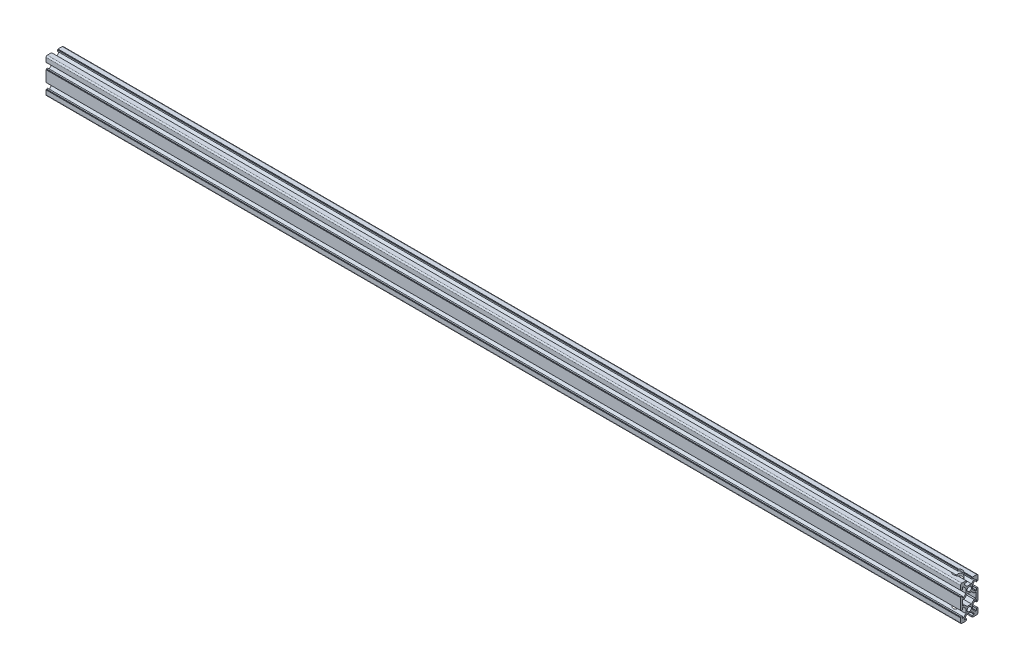
from build123d import *

# Parameters (mm, degrees)
SKETCH_1_W                = 1048
SKETCH_1_H                = 40
EXTRUDE_1_DEPTH           = 20
CUT_EXTRUDE_1_DEPTH       = 1049.239330799
CUT_EXTRUDE_2_REACH       = 1050.811
CUT_EXTRUDE_3_REACH       = 1050.239
CUT_EXTRUDE_3_END_RADIUS  = 5
SKETCH_4_W                = 0.605
SKETCH_4_H                = 0.5
CUT_EXTRUDE_4_DEPTH       = 1049.239330799
CUT_EXTRUDE_5_DEPTH       = 1049.737119623
CUT_EXTRUDE_6_REACH       = 1050.239
CUT_EXTRUDE_6_END_RADIUS  = 5
SKETCH_7_W                = 0.605
SKETCH_7_H                = 0.5
CUT_EXTRUDE_7_REACH       = 1050.811
CUT_EXTRUDE_8_REACH       = 1050.239
CUT_EXTRUDE_8_END_RADIUS  = 5
SKETCH_9_W                = 0.605
SKETCH_9_H                = 0.5
CUT_EXTRUDE_9_REACH       = 1050.239
CUT_EXTRUDE_9_END_RADIUS  = 5
SKETCH_10_W               = 0.605
SKETCH_10_H               = 0.5
CUT_EXTRUDE_10_DEPTH      = 1049.737119623
CUT_EXTRUDE_11_REACH      = 1050.239
CUT_EXTRUDE_11_END_RADIUS = 5
SKETCH_12_W               = 0.605
SKETCH_12_H               = 0.5
CUT_EXTRUDE_12_DEPTH      = 1049.239330799
CUT_EXTRUDE_13_DEPTH      = 1049.239330799
CUT_EXTRUDE_14_REACH      = 1050.239
CUT_EXTRUDE_14_END_RADIUS = 5
SKETCH_15_W               = 0.605
SKETCH_15_H               = 0.5
CUT_EXTRUDE_15_REACH      = 1050.239
CUT_EXTRUDE_15_END_RADIUS = 5
SKETCH_16_W               = 0.605
SKETCH_16_H               = 0.5
CUT_EXTRUDE_16_DEPTH      = 1049.239330799
CUT_EXTRUDE_17_DEPTH      = 1049.239330799
CUT_EXTRUDE_18_REACH      = 1050.239
CUT_EXTRUDE_18_END_RADIUS = 5
SKETCH_19_W               = 0.605
SKETCH_19_H               = 0.5
CUT_EXTRUDE_19_DEPTH      = 1049.239330799
DRAFT_1_ANGLE             = 45
DRAFT_2_ANGLE             = 45
SKETCH_21_W               = 5
SKETCH_21_H               = 5.49122085
SKETCH_22_W               = 5
SKETCH_22_H               = 5.49864809
HOLE_WIZARD_5_0_5_1_D     = 4.999999999
HOLE_WIZARD_5_0_5_2_D     = 4.999999999
FILLET_1_R                = 1.5


with BuildPart() as part:
    # 草图1 → 凸台-拉伸1 (new body)
    with BuildSketch(Plane.XY.offset(9.92299271)):
        with Locations((-524, -0.00371362)):
            Rectangle(SKETCH_1_W, SKETCH_1_H)
    extrude(amount=-EXTRUDE_1_DEPTH)

    # 草图2 → 切除-拉伸1 (cut, through all)
    with BuildSketch(Plane(origin=(0, 0, 0), x_dir=(0, 0, -1), z_dir=(1, 0, 0))):
        Polygon((-3.02299271, 19.99628638), (-3.02299271, 17.99628638), (-5.42299271, 17.99628638), (-5.42299271, 16.91049994), (-2.40877915, 13.89628638), (2.56279373, 13.89628638), (5.57700729, 16.91049994), (5.57700729, 17.99628638), (3.17700729, 17.99628638), (3.17700729, 19.99628638), align=None)
    extrude(amount=-CUT_EXTRUDE_1_DEPTH, mode=Mode.SUBTRACT)

    # 草图3 → 切除-拉伸2 (cut, up to next)
    with BuildSketch(Plane(origin=(0, 19.99628638, 0), x_dir=(-1, 0, 0), z_dir=(0, 1, 0)), mode=Mode.PRIVATE) as cut_extrude_2_sk1:
        with BuildLine():
            Line((9.017348236, 3.02299271), (16.982651764, 3.02299271))
            ThreePointArc((16.982651764, 3.02299271), (13, 5), (9.017348236, 3.02299271))
        make_face()
    cut_extrude_2_tool1 = extrude(cut_extrude_2_sk1.sketch, amount=-CUT_EXTRUDE_2_REACH, mode=Mode.PRIVATE) & part.part
    add(cut_extrude_2_tool1.solids().sort_by_distance((-13, 19.996286, 3.828944))[0], mode=Mode.SUBTRACT)

    # 切除-拉伸3: up to this cylinder (the profile starts outside it)
    cut_extrude_3_end = Plane(origin=(-13, 19.746286, 0), z_dir=(0, 1, 0)) * Cylinder(CUT_EXTRUDE_3_END_RADIUS, 2111.478, mode=Mode.PRIVATE)
    # 草图4 → 切除-拉伸3 (cut, up to the surface)
    with BuildSketch(Plane.ZY.offset(1048), mode=Mode.PRIVATE) as cut_extrude_3_sk1:
        with Locations((3.32549271, 19.74628638)):
            Rectangle(SKETCH_4_W, SKETCH_4_H)
    cut_extrude_3_tool1 = extrude(cut_extrude_3_sk1.sketch, amount=-CUT_EXTRUDE_3_REACH, mode=Mode.PRIVATE) - cut_extrude_3_end
    add(cut_extrude_3_tool1.solids().sort_by_distance((-1048, 19.746286, 3.325493))[0], mode=Mode.SUBTRACT)

    # 草图5 → 切除-拉伸4 (cut, through all)
    with BuildSketch(Plane(origin=(0, 0, 0), x_dir=(0, 0, -1), z_dir=(1, 0, 0))):
        Polygon((-3.02299271, -20.00371362), (3.17700729, -20.00371362), (3.17700729, -18.00371362), (5.57700729, -18.00371362), (5.57700729, -16.91792718), (2.56279373, -13.90371362), (-2.40877915, -13.90371362), (-5.42299271, -16.91792718), (-5.42299271, -18.00371362), (-3.02299271, -18.00371362), align=None)
    extrude(amount=-CUT_EXTRUDE_4_DEPTH, mode=Mode.SUBTRACT)

    # 草图6 → 切除-拉伸5 (cut, through all)
    with BuildSketch(Plane(origin=(0, -18.00371362, 0), x_dir=(-1, 0, 0), z_dir=(0, 1, 0))):
        with BuildLine():
            Line((9.017348236, 3.02299271), (16.982651764, 3.02299271))
            ThreePointArc((16.982651764, 3.02299271), (13, 5), (9.017348236, 3.02299271))
        make_face()
    extrude(amount=-CUT_EXTRUDE_5_DEPTH, mode=Mode.SUBTRACT)

    # 切除-拉伸6: up to this cylinder (the profile starts outside it)
    cut_extrude_6_end = Plane(origin=(-13, -19.753714, 0), z_dir=(0, 1, 0)) * Cylinder(CUT_EXTRUDE_6_END_RADIUS, 2111.478, mode=Mode.PRIVATE)
    # 草图7 → 切除-拉伸6 (cut, up to the surface)
    with BuildSketch(Plane.ZY.offset(1048), mode=Mode.PRIVATE) as cut_extrude_6_sk1:
        with Locations((3.32549271, -19.75371362)):
            Rectangle(SKETCH_7_W, SKETCH_7_H)
    cut_extrude_6_tool1 = extrude(cut_extrude_6_sk1.sketch, amount=-CUT_EXTRUDE_6_REACH, mode=Mode.PRIVATE) - cut_extrude_6_end
    add(cut_extrude_6_tool1.solids().sort_by_distance((-1048, -19.753714, 3.325493))[0], mode=Mode.SUBTRACT)

    # 草图8 → 切除-拉伸7 (cut, up to next)
    with BuildSketch(Plane.XZ.offset(20.00371362), mode=Mode.PRIVATE) as cut_extrude_7_sk1:
        with BuildLine():
            Line((-9.139090175, -3.17700729), (-16.860909825, -3.17700729))
            ThreePointArc((-16.860909825, -3.17700729), (-13, -5), (-9.139090175, -3.17700729))
        make_face()
    cut_extrude_7_tool1 = extrude(cut_extrude_7_sk1.sketch, amount=-CUT_EXTRUDE_7_REACH, mode=Mode.PRIVATE) & part.part
    add(cut_extrude_7_tool1.solids().sort_by_distance((-13, -20.003714, -3.918953))[0], mode=Mode.SUBTRACT)

    # 切除-拉伸8: up to this cylinder (the profile starts outside it)
    cut_extrude_8_end = Plane(origin=(-13, -19.753714, 0), z_dir=(0, -1, 0)) * Cylinder(CUT_EXTRUDE_8_END_RADIUS, 2111.478, mode=Mode.PRIVATE)
    # 草图9 → 切除-拉伸8 (cut, up to the surface)
    with BuildSketch(Plane.ZY.offset(1048), mode=Mode.PRIVATE) as cut_extrude_8_sk1:
        with Locations((-3.47950729, -19.75371362)):
            Rectangle(SKETCH_9_W, SKETCH_9_H)
    cut_extrude_8_tool1 = extrude(cut_extrude_8_sk1.sketch, amount=-CUT_EXTRUDE_8_REACH, mode=Mode.PRIVATE) - cut_extrude_8_end
    add(cut_extrude_8_tool1.solids().sort_by_distance((-1048, -19.753714, -3.479507))[0], mode=Mode.SUBTRACT)

    # 切除-拉伸9: up to this cylinder (the profile starts outside it)
    cut_extrude_9_end = Plane(origin=(-13, 19.746286, 0), z_dir=(0, 1, 0)) * Cylinder(CUT_EXTRUDE_9_END_RADIUS, 2111.478, mode=Mode.PRIVATE)
    # 草图10 → 切除-拉伸9 (cut, up to the surface)
    with BuildSketch(Plane(origin=(0, 0, 0), x_dir=(0, 0, -1), z_dir=(1, 0, 0)), mode=Mode.PRIVATE) as cut_extrude_9_sk1:
        with Locations((-3.32549271, 19.74628638)):
            Rectangle(SKETCH_10_W, SKETCH_10_H)
    cut_extrude_9_tool1 = extrude(cut_extrude_9_sk1.sketch, amount=-CUT_EXTRUDE_9_REACH, mode=Mode.PRIVATE) - cut_extrude_9_end
    add(cut_extrude_9_tool1.solids().sort_by_distance((0, 19.746286, 3.325493))[0], mode=Mode.SUBTRACT)

    # 草图11 → 切除-拉伸10 (cut, through all)
    with BuildSketch(Plane.XZ.offset(-17.99628638)):
        with BuildLine():
            Line((-9.139090175, -3.17700729), (-16.860909825, -3.17700729))
            ThreePointArc((-16.860909825, -3.17700729), (-13, -5), (-9.139090175, -3.17700729))
        make_face()
    extrude(amount=-CUT_EXTRUDE_10_DEPTH, mode=Mode.SUBTRACT)

    # 切除-拉伸11: up to this cylinder (the profile starts outside it)
    cut_extrude_11_end = Plane(origin=(-13, 19.746286, 0), z_dir=(0, -1, 0)) * Cylinder(CUT_EXTRUDE_11_END_RADIUS, 2111.478, mode=Mode.PRIVATE)
    # 草图12 → 切除-拉伸11 (cut, up to the surface)
    with BuildSketch(Plane(origin=(0, 0, 0), x_dir=(0, 0, -1), z_dir=(1, 0, 0)), mode=Mode.PRIVATE) as cut_extrude_11_sk1:
        with Locations((3.47950729, 19.74628638)):
            Rectangle(SKETCH_12_W, SKETCH_12_H)
    cut_extrude_11_tool1 = extrude(cut_extrude_11_sk1.sketch, amount=-CUT_EXTRUDE_11_REACH, mode=Mode.PRIVATE) - cut_extrude_11_end
    add(cut_extrude_11_tool1.solids().sort_by_distance((0, 19.746286, -3.479507))[0], mode=Mode.SUBTRACT)

    # 草图13 → 切除-拉伸12 (cut, through all)
    with BuildSketch(Plane(origin=(0, 0, 0), x_dir=(0, 0, -1), z_dir=(1, 0, 0))):
        Polygon((10.07700729, 13.70128638), (9.57700729, 13.70128638), (9.57700729, 13.09628638), (8.07700729, 13.09628638), (8.07700729, 15.49628638), (6.99122085, 15.49628638), (3.97700729, 12.48207282), (3.97700729, 7.51049994), (6.99122085, 4.49628638), (8.07700729, 4.49628638), (8.07700729, 6.89628638), (9.57700729, 6.89628638), (9.57700729, 6.29128638), (10.07700729, 6.29128638), align=None)
    extrude(amount=-CUT_EXTRUDE_12_DEPTH, mode=Mode.SUBTRACT)

    # 草图14 → 切除-拉伸13 (cut, through all)
    with BuildSketch(Plane(origin=(0, 0, 0), x_dir=(0, 0, -1), z_dir=(1, 0, 0))):
        Polygon((10.07700729, -6.29871362), (9.57700729, -6.29871362), (9.57700729, -6.90371362), (8.07700729, -6.90371362), (8.07700729, -4.50371362), (6.99122085, -4.50371362), (3.97700729, -7.51792718), (3.97700729, -12.48950006), (6.99122085, -15.50371362), (8.07700729, -15.50371362), (8.07700729, -13.10371362), (9.57700729, -13.10371362), (9.57700729, -13.70871362), (10.07700729, -13.70871362), align=None)
    extrude(amount=-CUT_EXTRUDE_13_DEPTH, mode=Mode.SUBTRACT)

    # 切除-拉伸14: up to this cylinder (the profile starts outside it)
    cut_extrude_14_end = Plane(origin=(-13, -19.753714, 0), z_dir=(0, -1, 0)) * Cylinder(CUT_EXTRUDE_14_END_RADIUS, 2111.478, mode=Mode.PRIVATE)
    # 草图15 → 切除-拉伸14 (cut, up to the surface)
    with BuildSketch(Plane(origin=(0, 0, 0), x_dir=(0, 0, -1), z_dir=(1, 0, 0)), mode=Mode.PRIVATE) as cut_extrude_14_sk1:
        with Locations((3.47950729, -19.75371362)):
            Rectangle(SKETCH_15_W, SKETCH_15_H)
    cut_extrude_14_tool1 = extrude(cut_extrude_14_sk1.sketch, amount=-CUT_EXTRUDE_14_REACH, mode=Mode.PRIVATE) - cut_extrude_14_end
    add(cut_extrude_14_tool1.solids().sort_by_distance((0, -19.753714, -3.479507))[0], mode=Mode.SUBTRACT)

    # 切除-拉伸15: up to this cylinder (the profile starts outside it)
    cut_extrude_15_end = Plane(origin=(-13, -19.753714, 0), z_dir=(0, 1, 0)) * Cylinder(CUT_EXTRUDE_15_END_RADIUS, 2111.478, mode=Mode.PRIVATE)
    # 草图16 → 切除-拉伸15 (cut, up to the surface)
    with BuildSketch(Plane(origin=(0, 0, 0), x_dir=(0, 0, -1), z_dir=(1, 0, 0)), mode=Mode.PRIVATE) as cut_extrude_15_sk1:
        with Locations((-3.32549271, -19.75371362)):
            Rectangle(SKETCH_16_W, SKETCH_16_H)
    cut_extrude_15_tool1 = extrude(cut_extrude_15_sk1.sketch, amount=-CUT_EXTRUDE_15_REACH, mode=Mode.PRIVATE) - cut_extrude_15_end
    add(cut_extrude_15_tool1.solids().sort_by_distance((0, -19.753714, 3.325493))[0], mode=Mode.SUBTRACT)

    # 草图17 → 切除-拉伸16 (cut, through all)
    with BuildSketch(Plane(origin=(0, 0, 0), x_dir=(0, 0, -1), z_dir=(1, 0, 0))):
        Polygon((-9.92299271, -13.70871362), (-9.42299271, -13.70871362), (-9.42299271, -13.10371362), (-7.92299271, -13.10371362), (-7.92299271, -15.50371362), (-6.83720627, -15.50371362), (-3.82299271, -12.48950006), (-3.82299271, -7.51792718), (-6.83720627, -4.50371362), (-7.92299271, -4.50371362), (-7.92299271, -6.90371362), (-9.42299271, -6.90371362), (-9.42299271, -6.29871362), (-9.92299271, -6.29871362), align=None)
    extrude(amount=-CUT_EXTRUDE_16_DEPTH, mode=Mode.SUBTRACT)

    # 草图18 → 切除-拉伸17 (cut, through all)
    with BuildSketch(Plane(origin=(0, 0, 0), x_dir=(0, 0, -1), z_dir=(1, 0, 0))):
        Polygon((-9.92299271, 6.29128638), (-9.42299271, 6.29128638), (-9.42299271, 6.89628638), (-7.92299271, 6.89628638), (-7.92299271, 4.49628638), (-6.83720627, 4.49628638), (-3.82299271, 7.51049994), (-3.82299271, 12.48207282), (-6.83720627, 15.49628638), (-7.92299271, 15.49628638), (-7.92299271, 13.09628638), (-9.42299271, 13.09628638), (-9.42299271, 13.70128638), (-9.92299271, 13.70128638), align=None)
    extrude(amount=-CUT_EXTRUDE_17_DEPTH, mode=Mode.SUBTRACT)

    # 切除-拉伸18: up to this cylinder (the profile starts outside it)
    cut_extrude_18_end = Plane(origin=(-13, 19.746286, 0), z_dir=(0, -1, 0)) * Cylinder(CUT_EXTRUDE_18_END_RADIUS, 2111.478, mode=Mode.PRIVATE)
    # 草图19 → 切除-拉伸18 (cut, up to the surface)
    with BuildSketch(Plane.ZY.offset(1048), mode=Mode.PRIVATE) as cut_extrude_18_sk1:
        with Locations((-3.47950729, 19.74628638)):
            Rectangle(SKETCH_19_W, SKETCH_19_H)
    cut_extrude_18_tool1 = extrude(cut_extrude_18_sk1.sketch, amount=-CUT_EXTRUDE_18_REACH, mode=Mode.PRIVATE) - cut_extrude_18_end
    add(cut_extrude_18_tool1.solids().sort_by_distance((-1048, 19.746286, -3.479507))[0], mode=Mode.SUBTRACT)

    # 草图20 → 切除-拉伸19 (cut, through all)
    with BuildSketch(Plane.ZY.offset(1048)):
        Polygon((2.40877915, -3.08950006), (7.42299271, -3.08950006), (7.42299271, 3.08207282), (2.40877915, 3.08207282), (2.40877915, 6.09628638), (-2.56279373, 6.09628638), (-2.56279373, 3.08207282), (-7.57700729, 3.08207282), (-7.57700729, -3.08950006), (-2.56279373, -3.08950006), (-2.56279373, -6.10371362), (2.40877915, -6.10371362), align=None)
    extrude(amount=-CUT_EXTRUDE_19_DEPTH, mode=Mode.SUBTRACT)

    # 拔模1
    draft_1_faces = [part.faces().sort_by_distance(p)[0] for p in [
        (-524, -4.59660684, 2.40877915),
        (-524, -4.59660684, -2.56279373),
    ]]
    draft(draft_1_faces, Plane(origin=(0, -6.10371362, -2.56279373), x_dir=(0, 0, 1), z_dir=(0, 1, 0)), DRAFT_1_ANGLE)

    # 拔模2
    draft_2_faces = [part.faces().sort_by_distance(p)[0] for p in [
        (-524, 4.5891796, -2.56279373),
        (-524, 4.5891796, 2.40877915),
    ]]
    draft(draft_2_faces, Plane(origin=(0, 6.09628638, 2.40877915), x_dir=(0, 0, -1), z_dir=(0, -1, 0)), DRAFT_2_ANGLE)

    # 草图21 → 切除-旋转1 (revolve, cut)
    with BuildSketch(Plane(origin=(0, 0, 0), x_dir=(-1, 0, 0), z_dir=(0, 0, -1)), mode=Mode.PRIVATE) as cut_revolve_1_sk:
        with Locations((10.5, 13.741896805)):
            Rectangle(SKETCH_21_W, SKETCH_21_H)
    revolve(cut_revolve_1_sk.sketch.rotate(Axis((-13, 10.99628638, 0), (0, 1, 0)), 229.871289748), axis=Axis((-13, 10.99628638, 0), (0, 1, 0)), mode=Mode.SUBTRACT)

    # 草图22 → 切除-旋转2 (revolve, cut)
    with BuildSketch(Plane.XY, mode=Mode.PRIVATE) as cut_revolve_2_sk:
        with Locations((-10.5, -13.745610425)):
            Rectangle(SKETCH_22_W, SKETCH_22_H)
    revolve(cut_revolve_2_sk.sketch.rotate(Axis((-13, -10.99628638, 0), (0, -1, 0)), 232.693190821), axis=Axis((-13, -10.99628638, 0), (0, -1, 0)), mode=Mode.SUBTRACT)

    # Ø5.0 (5) 直径孔1 (through all)
    with Locations(Plane(origin=(0, 0, 0), x_dir=(0, 0, -1), z_dir=(1, 0, 0))):
        with Locations((0.07700729, 9.99628638)):
            Hole(HOLE_WIZARD_5_0_5_1_D / 2)

    # Ø5.0 (5) 直径孔2 (through all)
    with Locations(Plane.ZY.offset(1048)):
        with Locations((-0.07700729, -10.00371362)):
            Hole(HOLE_WIZARD_5_0_5_2_D / 2)

    # 圆角1
    fillet_1_edges = [part.edges().sort_by_distance(p)[0] for p in [
        (-524, -20.00371362, -10.07700729),
        (-524, 19.99628638, -10.07700729),
        (-524, -20.00371362, 9.92299271),
        (-524, 19.99628638, 9.92299271),
    ]]
    fillet(fillet_1_edges, radius=FILLET_1_R)


solid = part.part
